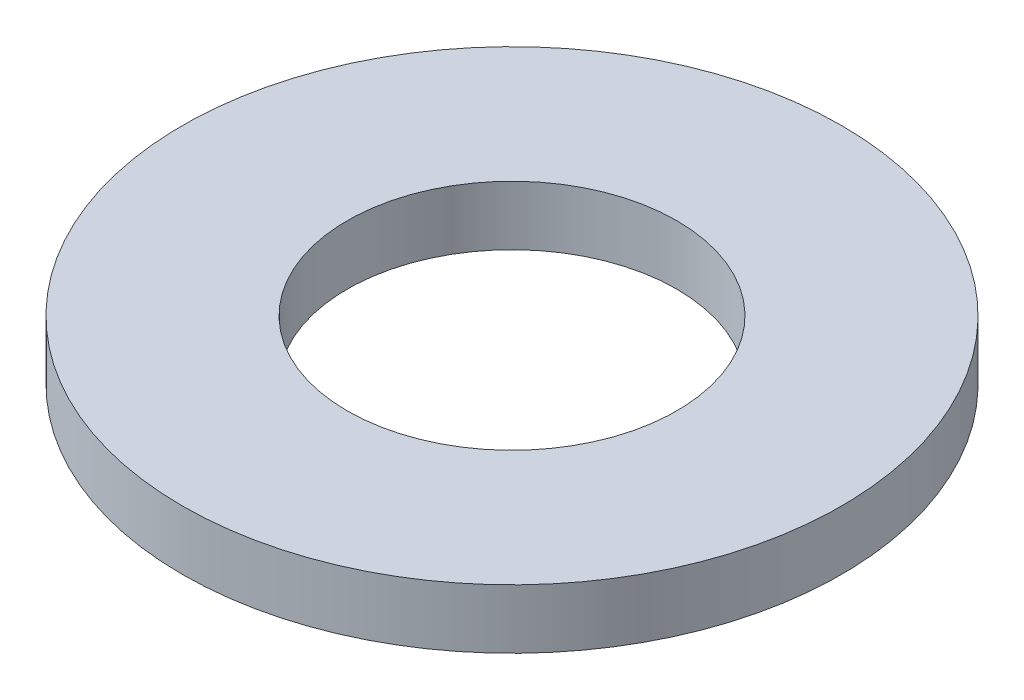
from build123d import *

# Parameters (mm, degrees)
SKETCH_1_R      = 10
SKETCH_1_R_2    = 5
EXTRUDE_1_DEPTH = 1.8


with BuildPart() as part:
    # Эскиз1 → Бобышка-Вытянуть1 (new body)
    with BuildSketch(Plane(origin=(0, 0, 0), x_dir=(1, 0, 0), z_dir=(0, 1, 0))):
        with Locations(Location((0, 0, 0), (0, 0, 270))):
            Circle(SKETCH_1_R)
        with Locations(Location((0, 0, 0), (0, 0, 270))):
            Circle(SKETCH_1_R_2, mode=Mode.SUBTRACT)
    extrude(amount=EXTRUDE_1_DEPTH)


solid = part.part
